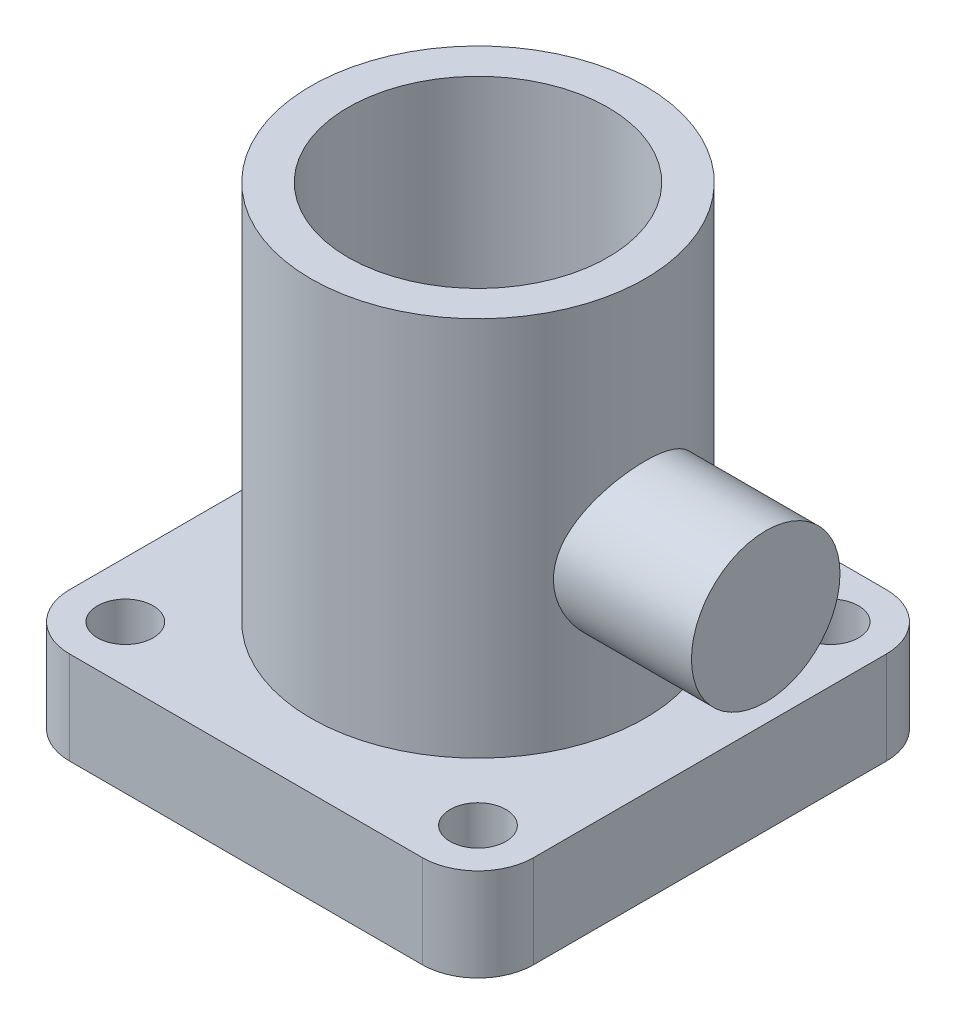
from build123d import *

# Parameters (mm, degrees)
SKETCH_3_W           = 50
SKETCH_3_H           = 50
EXTRUDE_1_DEPTH      = 10
FILLET_7_R           = 6
FILLET_8_R           = 6
FILLET_9_R           = 6
FILLET_10_R          = 6
SKETCH_4_R           = 3
CUT_EXTRUDE_1_DEPTH  = 37.742346142
SKETCH_6_R           = 3
CUT_EXTRUDE_14_DEPTH = 37.742346142
SKETCH_7_R           = 3
CUT_EXTRUDE_15_DEPTH = 37.742346142
SKETCH_8_R           = 3
CUT_EXTRUDE_16_DEPTH = 37.742346142
SKETCH_9_R           = 18
EXTRUDE_4_DEPTH      = 51
SKETCH_12_R          = 8
EXTRUDE_5_DEPTH      = 31
SKETCH_10_R          = 14
CUT_EXTRUDE_17_DEPTH = 65.707032123


with BuildPart() as part:
    # 草图3 → 凸台-拉伸1 (new body)
    with BuildSketch(Plane(origin=(0, 0, 0), x_dir=(1, 0, 0), z_dir=(0, 1, 0))):
        Rectangle(SKETCH_3_W, SKETCH_3_H)
    extrude(amount=EXTRUDE_1_DEPTH)

    # 圆角7
    fillet_7_edges = [part.edges().sort_by_distance(p)[0] for p in [
        (-25, 5, -25),
    ]]
    fillet(fillet_7_edges, radius=FILLET_7_R)

    # 圆角8
    fillet_8_edges = [part.edges().sort_by_distance(p)[0] for p in [
        (-25, 5, 25),
    ]]
    fillet(fillet_8_edges, radius=FILLET_8_R)

    # 圆角9
    fillet_9_edges = [part.edges().sort_by_distance(p)[0] for p in [
        (25, 5, 25),
    ]]
    fillet(fillet_9_edges, radius=FILLET_9_R)

    # 圆角10
    fillet_10_edges = [part.edges().sort_by_distance(p)[0] for p in [
        (25, 5, -25),
    ]]
    fillet(fillet_10_edges, radius=FILLET_10_R)

    # 草图4 → 切除-拉伸1 (cut, through all)
    with BuildSketch(Plane(origin=(0, 10, 0), x_dir=(1, 0, 0), z_dir=(0, 1, 0))):
        with Locations(Location((-19, -19, 0), (0, 0, 270))):
            Circle(SKETCH_4_R)
    extrude(amount=-CUT_EXTRUDE_1_DEPTH, mode=Mode.SUBTRACT)

    # 草图6 → 切除-拉伸14 (cut, through all)
    with BuildSketch(Plane(origin=(0, 10, 0), x_dir=(1, 0, 0), z_dir=(0, 1, 0))):
        with Locations(Location((-19, 19, 0), (0, 0, 270))):
            Circle(SKETCH_6_R)
    extrude(amount=-CUT_EXTRUDE_14_DEPTH, mode=Mode.SUBTRACT)

    # 草图7 → 切除-拉伸15 (cut, through all)
    with BuildSketch(Plane(origin=(0, 10, 0), x_dir=(1, 0, 0), z_dir=(0, 1, 0))):
        with Locations(Location((19, 19, 0), (0, 0, 270))):
            Circle(SKETCH_7_R)
    extrude(amount=-CUT_EXTRUDE_15_DEPTH, mode=Mode.SUBTRACT)

    # 草图8 → 切除-拉伸16 (cut, through all)
    with BuildSketch(Plane(origin=(0, 10, 0), x_dir=(1, 0, 0), z_dir=(0, 1, 0))):
        with Locations(Location((19, -19, 0), (0, 0, 270))):
            Circle(SKETCH_8_R)
    extrude(amount=-CUT_EXTRUDE_16_DEPTH, mode=Mode.SUBTRACT)

    # 草图9 → 凸台-拉伸4 (add)
    with BuildSketch(Plane(origin=(0, 0, 0), x_dir=(1, 0, 0), z_dir=(0, 1, 0))):
        with Locations(Location((0, 0, 0), (0, 0, 90))):
            Circle(SKETCH_9_R)
    extrude(amount=EXTRUDE_4_DEPTH)

    # 草图12 → 凸台-拉伸5 (add)
    with BuildSketch(Plane(origin=(0, 0, 0), x_dir=(0, 0, -1), z_dir=(1, 0, 0))):
        with Locations(Location((0, 26, 0), (0, 0, 180))):
            Circle(SKETCH_12_R)
    extrude(amount=EXTRUDE_5_DEPTH)

    # 草图10 → 切除-拉伸17 (cut, through all)
    with BuildSketch(Plane(origin=(0, 51, 0), x_dir=(1, 0, 0), z_dir=(0, 1, 0))):
        with Locations(Location((0, 0, 0), (0, 0, 270))):
            Circle(SKETCH_10_R)
    extrude(amount=-CUT_EXTRUDE_17_DEPTH, mode=Mode.SUBTRACT)


solid = part.part
